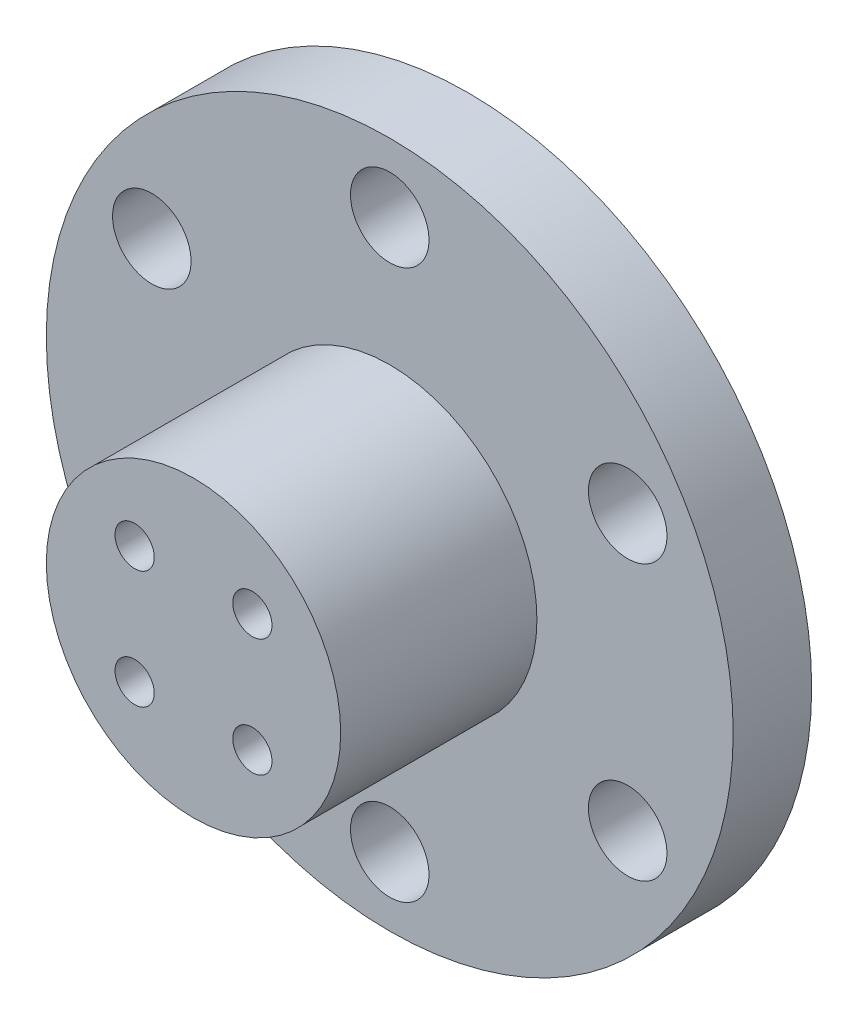
from build123d import *

# Parameters (mm, degrees)
SKETCH1_R           = 15
BOSS_EXTRUDE1_DEPTH = 20
SKETCH3_R           = 35
BOSS_EXTRUDE3_DEPTH = 8
SKETCH4_R           = 4
CUT_EXTRUDE1_DEPTH  = 8
SKETCH5_R           = 11
CUT_EXTRUDE2_DEPTH  = 8
SKETCH6_R           = 2
CUT_EXTRUDE3_DEPTH  = 15
FILLET1_R           = 1


with BuildPart() as part:
    # Sketch1 → Boss-Extrude1 (new body)
    with BuildSketch(Plane.XY):
        Circle(SKETCH1_R)
    extrude(amount=BOSS_EXTRUDE1_DEPTH)

    # Sketch3 → Boss-Extrude3 (add)
    with BuildSketch(Plane(origin=(0, 0, 0), x_dir=(-1, 0, 0), z_dir=(0, 0, -1))):
        Circle(SKETCH3_R)
    extrude(amount=BOSS_EXTRUDE3_DEPTH)

    # Sketch4 → Cut-Extrude1 (cut)
    with BuildSketch(Plane(origin=(0, 0, -8), x_dir=(-1, 0, 0), z_dir=(0, 0, -1))):
        with Locations((0, 28)):
            Circle(SKETCH4_R)
        with Locations((24.248711306, 14)):
            Circle(SKETCH4_R)
        with Locations((24.248711306, -14)):
            Circle(SKETCH4_R)
        with Locations((0, -28)):
            Circle(SKETCH4_R)
        with Locations((-24.248711306, -14)):
            Circle(SKETCH4_R)
        with Locations((-24.248711306, 14)):
            Circle(SKETCH4_R)
    extrude(amount=-CUT_EXTRUDE1_DEPTH, mode=Mode.SUBTRACT)

    # Sketch5 → Cut-Extrude2 (cut)
    with BuildSketch(Plane(origin=(0, 0, -8), x_dir=(-1, 0, 0), z_dir=(0, 0, -1))):
        Circle(SKETCH5_R)
    extrude(amount=-CUT_EXTRUDE2_DEPTH, mode=Mode.SUBTRACT)

    # Sketch6 → Cut-Extrude3 (cut)
    with BuildSketch(Plane.XY.offset(20)):
        with Locations((6, 6)):
            Circle(SKETCH6_R)
        with Locations(Location((-6, 6, 0), (0, 0, 180))):
            Circle(SKETCH6_R)
        with Locations(Location((6, -6, 0), (0, 0, 180))):
            Circle(SKETCH6_R)
        with Locations((-6, -6)):
            Circle(SKETCH6_R)
    extrude(amount=-CUT_EXTRUDE3_DEPTH, mode=Mode.SUBTRACT)

    # Fillet1
    fillet1_edges = [part.edges().sort_by_distance(p)[0] for p in [
        (11, 0, 0),
    ]]
    fillet(fillet1_edges, radius=FILLET1_R)


solid = part.part
